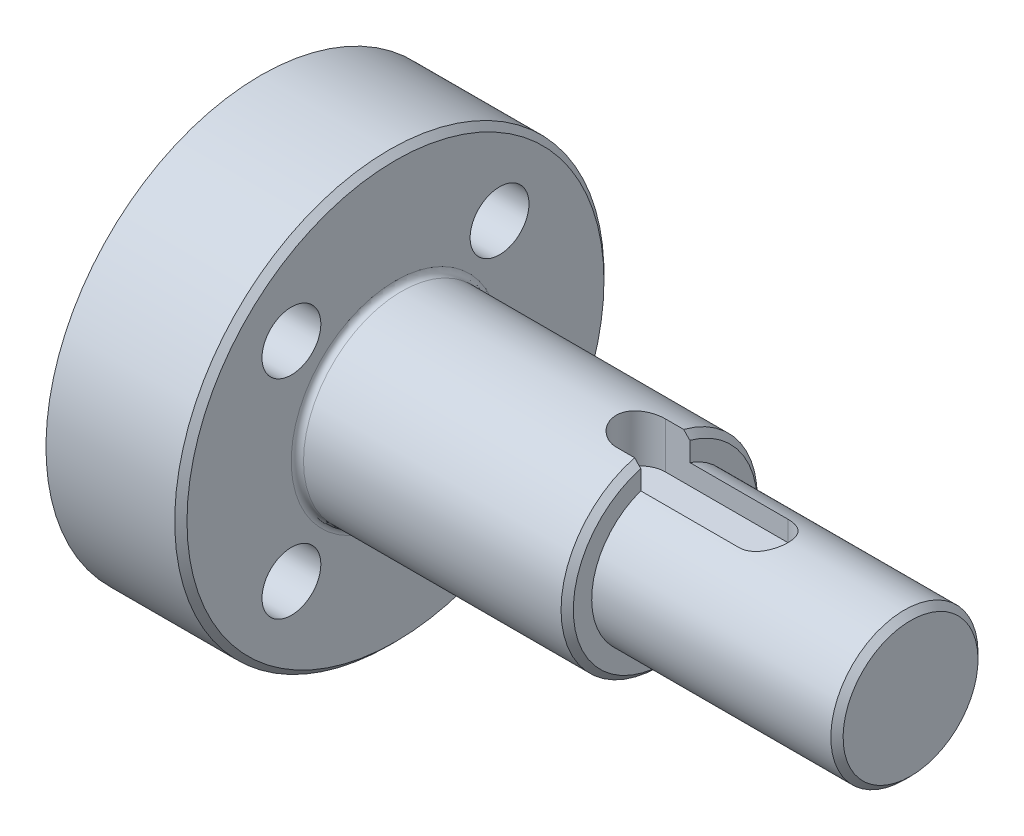
from build123d import *

# Parameters (mm, degrees)
M2_CLEARANCE_HOLE2_D = 2.4
CHAMFER2_SIZE        = 0.25
CUT_EXTRUDE1_START   = 2
CUT_EXTRUDE1_DEPTH   = 26.002314716
FILLET1_R            = 0.25


with BuildPart() as part:
    # Sketch1 → Revolve1 (revolve)
    with BuildSketch(Plane.XY):
        with BuildLine():
            Line((0, 0), (0, 8))
            ThreePointArc((0, 8), (-0.125, 8.216506351), (-0.375, 8.216506351))
            Line((-0.375, 8.216506351), (-0.75, 8))
            Line((-0.75, 8), (-2.5, 8))
            Line((-2.5, 8), (-2.5, 8.75))
            Line((-2.5, 8.75), (3, 8.75))
            Line((3, 8.75), (3, 4))
            Line((3, 4), (14, 4))
            Line((14, 4), (14, 3))
            Line((14, 3), (24, 3))
            Line((24, 3), (24, 0))
            Line((24, 0), (0, 0))
        make_face()
    revolve(axis=Axis((24, 0, 0), (-1, 0, 0)))

    # M2 Clearance Hole2 (through all)
    with Locations(Plane(origin=(3, 0, 0), x_dir=(0, 0, -1), z_dir=(1, 0, 0))):
        with Locations((4.242640687, 4.242640687), (-4.242640687, 4.242640687), (4.242640687, -4.242640687), (-4.242640687, -4.242640687)):
            Hole(M2_CLEARANCE_HOLE2_D / 2)

    # Chamfer2
    chamfer2_edges = [part.edges().sort_by_distance(p)[0] for p in [
        (3, -8.75, 0),
        (14, -4, 0),
        (24, -3, 0),
    ]]
    chamfer(chamfer2_edges, length=CHAMFER2_SIZE)

    # Sketch5 → Cut-Extrude1 (cut, through all)
    with BuildSketch(Plane(origin=(0, 0, 0), x_dir=(1, 0, 0), z_dir=(0, 1, 0)).offset(CUT_EXTRUDE1_START)):
        with BuildLine():
            Line((13, 1), (18, 1))
            ThreePointArc((18, 1), (19, 0), (18, -1))
            Line((18, -1), (13, -1))
            ThreePointArc((13, -1), (12, 0), (13, 1))
        make_face()
    extrude(amount=CUT_EXTRUDE1_DEPTH, mode=Mode.SUBTRACT)

    # Fillet1
    fillet1_edges = [part.edges().sort_by_distance(p)[0] for p in [
        (3, -4, 0),
    ]]
    fillet(fillet1_edges, radius=FILLET1_R)


solid = part.part
